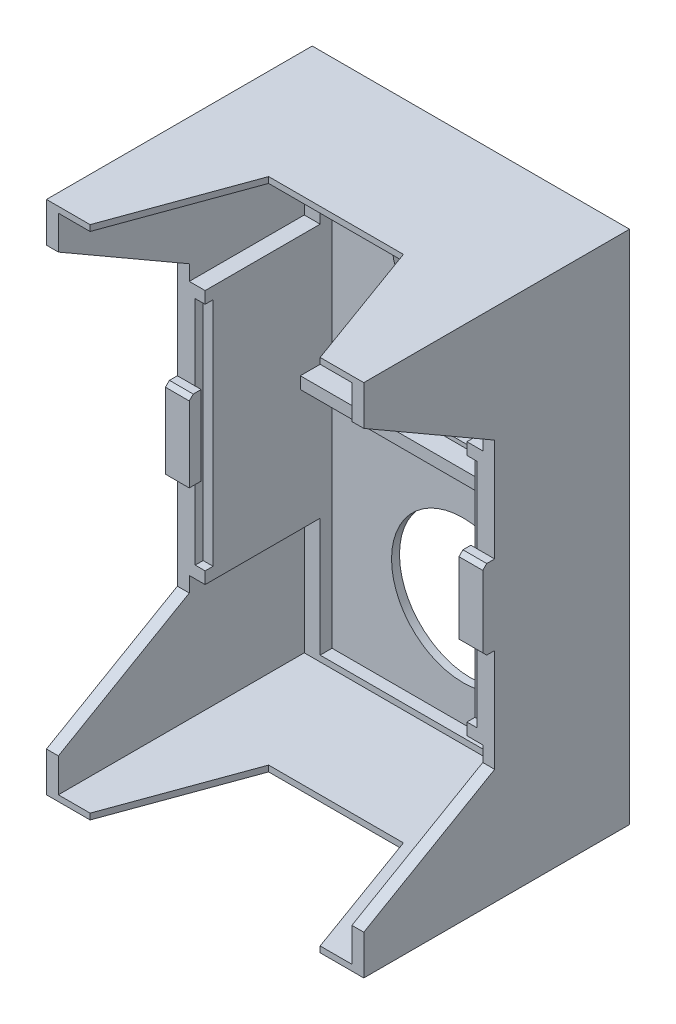
from build123d import *

# Parameters (mm, degrees)
SKETCH1_W                    = 130
SKETCH1_H                    = 80
SKETCH1_R                    = 18
BOSS_EXTRUDE1_DEPTH          = 2
SKETCH2_W                    = 7
SKETCH2_H                    = 130
BOSS_EXTRUDE2_DEPTH          = 30
BOSS_EXTRUDE3_DEPTH          = 35
SKETCH5_W                    = 150
SKETCH5_H                    = 110
CUT_EXTRUDE1_DEPTH           = 33
CUT_EXTRUDE1_DRAFT           = -30
SKETCH6_W                    = 6
SKETCH6_H                    = 20
BOSS_EXTRUDE4_DEPTH          = 3
CHAMFER1_SIZE                = 1
SKETCH7_W                    = 80
SKETCH7_H                    = 5
SKETCH7_H_2                  = 3
BOSS_EXTRUDE5_DEPTH          = 3
SKETCH9_W                    = 74
SKETCH9_H                    = 32.9
CUT_EXTRUDE2_DEPTH           = 99.33107342
SKETCH10_W                   = 72.40522931
SKETCH10_H                   = 3
BOSS_EXTRUDE6_DEPTH          = 5
SKETCH11_W                   = 80
SKETCH11_H                   = 1.5
BOSS_EXTRUDE7_DEPTH          = 62
SKETCH12_W                   = 58
SKETCH12_H                   = 28.83651326
CUT_EXTRUDE3_DEPTH           = 33
CUT_EXTRUDE3_DRAFT           = -20
CUT_EXTRUDE3_PROFILE_2_DEPTH = 33
CUT_EXTRUDE3_PROFILE_2_DRAFT = -20


with BuildPart() as part:
    # Sketch1 → Boss-Extrude1 (new body)
    with BuildSketch(Plane(origin=(0, 0, 0), x_dir=(0, 1, 0), z_dir=(0, 0, 1))):
        Rectangle(SKETCH1_W, SKETCH1_H)
        with Locations(Location((-35, 0, 0), (0, 0, 270))):
            Circle(SKETCH1_R, mode=Mode.SUBTRACT)
        with Locations(Location((35, 0, 0), (0, 0, 90))):
            Circle(SKETCH1_R, mode=Mode.SUBTRACT)
    extrude(amount=BOSS_EXTRUDE1_DEPTH)

    # Sketch2 → Boss-Extrude2 (add)
    with BuildSketch(Plane.XY.offset(2)):
        with Locations((-36.5, 0)):
            Rectangle(SKETCH2_W, SKETCH2_H)
        with Locations((36.5, 0)):
            Rectangle(SKETCH2_W, SKETCH2_H)
    extrude(amount=BOSS_EXTRUDE2_DEPTH)

    # Sketch4 → Boss-Extrude3 (add)
    with BuildSketch(Plane.XY.offset(32)):
        Polygon((-33, 29.1), (-35.5, 29.1), (-35.5, -29.1), (-33, -29.1), (-33, -65), (-40, -65), (-40, 65), (-33, 65), align=None)
        Polygon((35.5, -29.1), (35.5, 29.1), (33, 29.1), (33, 65), (40, 65), (40, -65), (33, -65), (33, -29.1), align=None)
    extrude(amount=BOSS_EXTRUDE3_DEPTH)


with BuildPart() as cut_extrude1_tool:
    # Sketch5 → Cut-Extrude1 (with draft: the straight prism first)
    with BuildSketch(Plane.XY.offset(67)):
        Rectangle(SKETCH5_W, SKETCH5_H)
    extrude(amount=-CUT_EXTRUDE1_DEPTH)
    # Cut-Extrude1: the draft: its side faces are tilted about the plane it starts from
    cut_extrude1_sides = [cut_extrude1_tool.faces().sort_by_distance(p)[0] for p in [
        (0, -55, 50.5),
        (75, 0, 50.5),
        (0, 55, 50.5),
        (-75, 0, 50.5),
    ]]
    draft(cut_extrude1_sides, Plane.XY.offset(67), CUT_EXTRUDE1_DRAFT)


with BuildPart() as part_1:
    add(part.part)

    # Cut-Extrude1: cut by cut_extrude1_tool
    add(cut_extrude1_tool.part, mode=Mode.SUBTRACT)

    # Sketch6 → Boss-Extrude4 (add)
    with BuildSketch(Plane.XY.offset(34)):
        with Locations((37, 0)):
            Rectangle(SKETCH6_W, SKETCH6_H)
        with Locations((-37, 0)):
            Rectangle(SKETCH6_W, SKETCH6_H)
    extrude(amount=BOSS_EXTRUDE4_DEPTH)

    # Chamfer1
    chamfer1_edges = [part_1.edges().sort_by_distance(p)[0] for p in [
        (37, 10, 37),
        (37, -10, 37),
        (-37, 10, 37),
    ]]
    chamfer(chamfer1_edges, length=CHAMFER1_SIZE)

    # Sketch7 → Boss-Extrude5 (add)
    with BuildSketch(Plane.XY.offset(2)):
        Rectangle(SKETCH7_W, SKETCH7_H)
        with Locations((0, -63.5)):
            Rectangle(SKETCH7_W, SKETCH7_H_2)
        with Locations((0, 63.5)):
            Rectangle(SKETCH7_W, SKETCH7_H_2)
    extrude(amount=BOSS_EXTRUDE5_DEPTH)

    # Sketch9 → Cut-Extrude2 (cut, through all)
    with BuildSketch(Plane.XY.offset(5)):
        with Locations((0, 48.55)):
            Rectangle(SKETCH9_W, SKETCH9_H)
        with Locations((0, -48.55)):
            Rectangle(SKETCH9_W, SKETCH9_H)
    extrude(amount=CUT_EXTRUDE2_DEPTH, mode=Mode.SUBTRACT)

    # Sketch10 → Boss-Extrude6 (add)
    with BuildSketch(Plane.XY.offset(5)):
        Rectangle(SKETCH10_W, SKETCH10_H)
    extrude(amount=BOSS_EXTRUDE6_DEPTH)

    # Sketch11 → Boss-Extrude7 (add)
    with BuildSketch(Plane.XY.offset(5)):
        with Locations((0, 64.25)):
            Rectangle(SKETCH11_W, SKETCH11_H)
        with Locations((0, -64.25)):
            Rectangle(SKETCH11_W, SKETCH11_H)
    extrude(amount=BOSS_EXTRUDE7_DEPTH)


with BuildPart() as cut_extrude3_tool:
    # Sketch12 → Cut-Extrude3 (with draft: the straight prism first)
    with BuildSketch(Plane.XY.offset(67)):
        with Locations((0, 63.5)):
            Rectangle(SKETCH12_W, SKETCH12_H)
    extrude(amount=-CUT_EXTRUDE3_DEPTH)
    # Cut-Extrude3: the draft: its side faces are tilted about the plane it starts from
    cut_extrude3_sides = [cut_extrude3_tool.faces().sort_by_distance(p)[0] for p in [
        (0, 49.08174337, 50.5),
        (29, 63.5, 50.5),
        (0, 77.91825663, 50.5),
        (-29, 63.5, 50.5),
    ]]
    draft(cut_extrude3_sides, Plane.XY.offset(67), CUT_EXTRUDE3_DRAFT)


with BuildPart() as part_2:
    add(part_1.part)

    # Cut-Extrude3: cut by cut_extrude3_tool
    add(cut_extrude3_tool.part, mode=Mode.SUBTRACT)


with BuildPart() as cut_extrude3_profile_2_tool:
    # Sketch12 → Cut-Extrude3 profile 2 (with draft: the straight prism first)
    with BuildSketch(Plane.XY.offset(67)):
        with Locations((0, -63.5)):
            Rectangle(SKETCH12_W, SKETCH12_H)
    extrude(amount=-CUT_EXTRUDE3_PROFILE_2_DEPTH)
    # Cut-Extrude3 profile 2: the draft: its side faces are tilted about the plane it starts from
    cut_extrude3_profile_2_sides = [cut_extrude3_profile_2_tool.faces().sort_by_distance(p)[0] for p in [
        (-29, -63.5, 50.5),
        (0, -77.91825663, 50.5),
        (29, -63.5, 50.5),
        (0, -49.08174337, 50.5),
    ]]
    draft(cut_extrude3_profile_2_sides, Plane.XY.offset(67), CUT_EXTRUDE3_PROFILE_2_DRAFT)


with BuildPart() as part_3:
    add(part_2.part)

    # Cut-Extrude3 profile 2: cut by cut_extrude3_profile_2_tool
    add(cut_extrude3_profile_2_tool.part, mode=Mode.SUBTRACT)


solid = part_3.part
